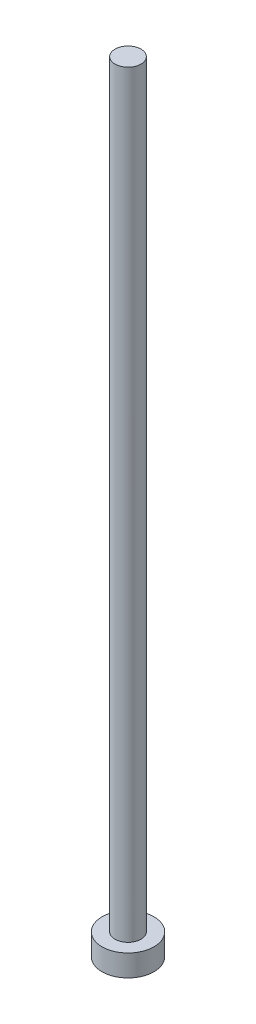
from build123d import *

# Parameters (mm, degrees)
SKETCH1_R           = 3
BOSS_EXTRUDE1_DEPTH = 175
SKETCH2_R           = 6
BOSS_EXTRUDE2_DEPTH = 5


with BuildPart() as part:
    # Sketch1 → Boss-Extrude1 (new body)
    with BuildSketch(Plane(origin=(0, 0, 0), x_dir=(1, 0, 0), z_dir=(0, 1, 0))):
        with Locations(Location((0, 0, 0), (0, 0, 270))):
            Circle(SKETCH1_R)
    extrude(amount=BOSS_EXTRUDE1_DEPTH)

    # Sketch2 → Boss-Extrude2 (add)
    with BuildSketch(Plane.XZ):
        with Locations(Location((0, 0, 0), (0, 0, 270))):
            Circle(SKETCH2_R)
    extrude(amount=BOSS_EXTRUDE2_DEPTH)


solid = part.part
